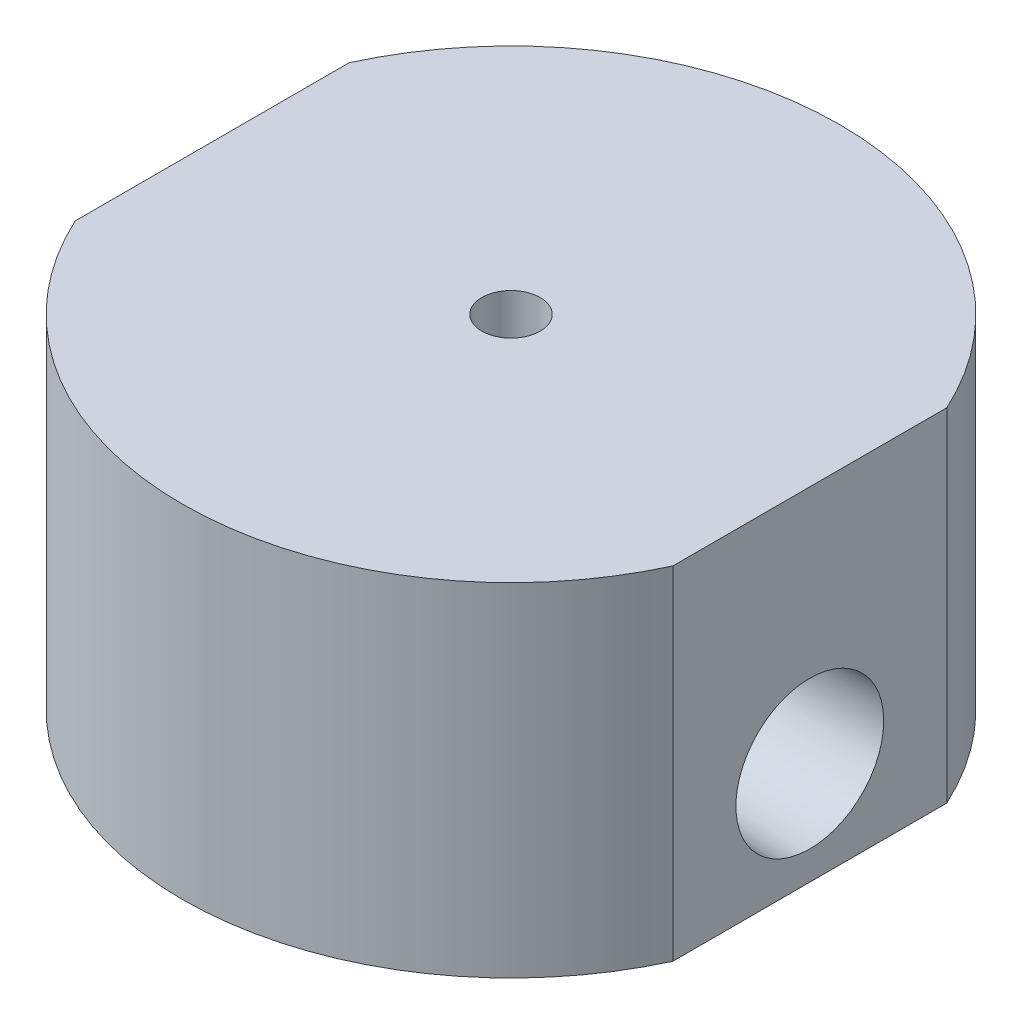
from build123d import *

# Parameters (mm, degrees)
F_1_4_28_TAPPED_HOLE1_D = 5.4102
SKETCH4_W               = 25.4
SKETCH4_H               = 25.4
FLATS_DEPTH             = 54.536186827
FILLET1_R               = 1.5875


with BuildPart() as part:
    # Sketch1 → Revolve1 (revolve)
    with BuildSketch(Plane.XY, mode=Mode.PRIVATE) as revolve1_sk:
        with BuildLine():
            Line((0, 31.75), (-30.48, 31.75))
            Line((-30.48, 31.75), (-30.48, 0))
            Line((-30.48, 0), (-17.145, 0))
            Line((-17.145, 0), (-17.145, 19.05))
            Line((-17.145, 19.05), (-13.97, 19.05))
            ThreePointArc((-13.97, 19.05), (-7.459314312, 16.353185688), (-4.7625, 9.8425))
            Line((-4.7625, 9.8425), (0, 9.8425))
            Line((0, 9.8425), (0, 31.75))
        make_face()
    revolve(revolve1_sk.sketch.rotate(Axis((0, 0, 0), (0, 1, 0)), 180), axis=Axis((0, 0, 0), (0, 1, 0)))

    # 1/4-28 Tapped Hole1 (through all)
    with Locations(Plane(origin=(0, 31.75, 0), x_dir=(1, 0, 0), z_dir=(0, 1, 0))):
        with Locations((0, 0)):
            Hole(F_1_4_28_TAPPED_HOLE1_D / 2)

    # Sketch4 → flats (cut, through all)
    with BuildSketch(Plane(origin=(0, 0, 0), x_dir=(1, 0, 0), z_dir=(0, 1, 0))):
        with Locations((-40.408128771, 0)):
            Rectangle(SKETCH4_W, SKETCH4_H)
        with Locations((40.408128771, 0)):
            Rectangle(SKETCH4_W, SKETCH4_H)
    extrude(amount=FLATS_DEPTH, mode=Mode.SUBTRACT)

    # Sketch6 → 1/4 NPT Tapped Hole1 (revolve, cut)
    with BuildSketch(Plane(origin=(27.708128771, 9.525, 0), x_dir=(0, 0, -1), z_dir=(0, 1, 0))):
        Polygon((0, 0), (0, 20.614347279), (5.5626, 17.272), (5.5626, 9.906), (6.557984794, 9.906), (6.8545837, 0), align=None)
    f_1_4_npt_tapped_hole1 = revolve(axis=Axis((34.058128771, 9.525, 0), (-1, 0, 0)), mode=Mode.SUBTRACT)

    # Mirror1: 1/4 NPT Tapped Hole1 across plane
    add(f_1_4_npt_tapped_hole1.mirror(Plane(origin=(0, 0, 0), x_dir=(0, 0, 1), z_dir=(1, 0, 0))), mode=Mode.SUBTRACT)

    # Fillet1
    fillet1_edges = [part.edges().sort_by_distance(p)[0] for p in [
        (-17.145, 19.05, 0),
    ]]
    fillet(fillet1_edges, radius=FILLET1_R)


solid = part.part
